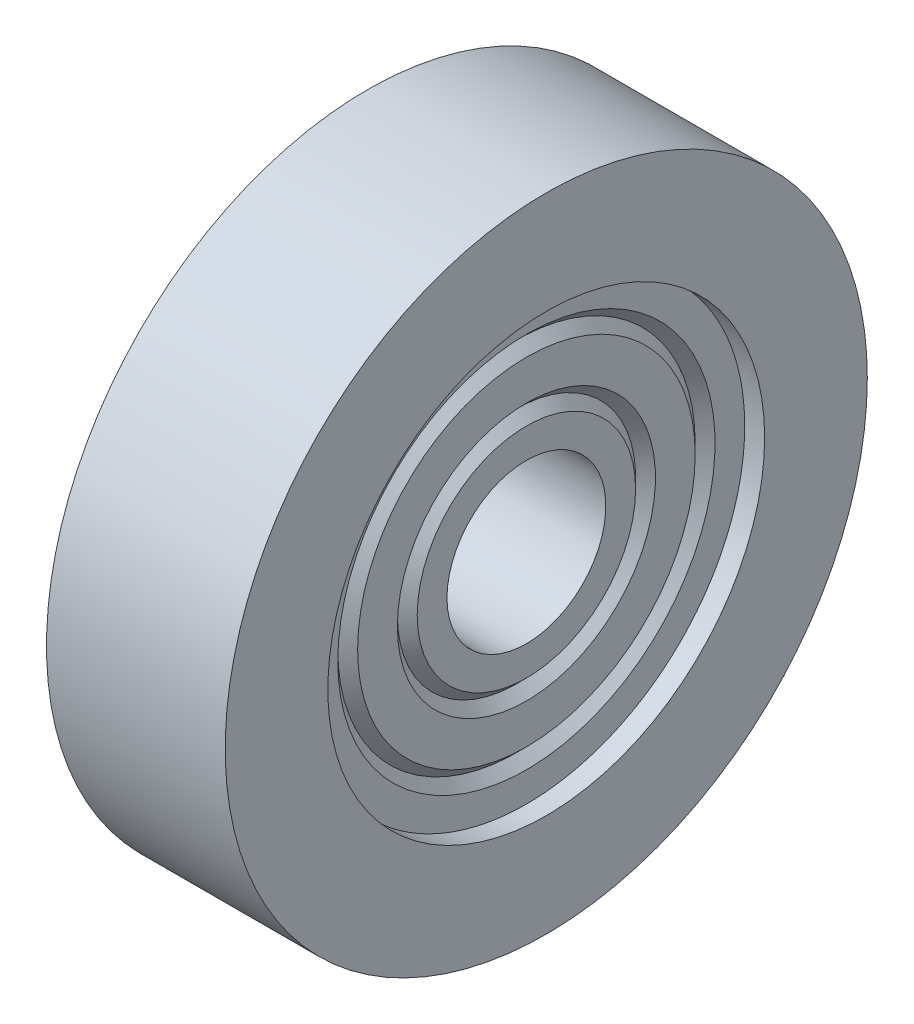
from build123d import *

# Parameters (mm, degrees)
ESQUISSE2_R        = 16.17
ESQUISSE2_R_2      = 11
BOSS_EXTRU_1_DEPTH = 4.5


with BuildPart() as part:
    # Esquisse1 → Base-Révolution (revolve)
    with BuildSketch(Plane.XY, mode=Mode.PRIVATE) as base_r_volution_sk:
        Polygon((-3.5, 4), (3.5, 4), (3.5, 5.5), (3, 6), (3.5, 6.5), (3.5, 8.5), (3, 9), (3.5, 9.5), (3.5, 11), (-3.5, 11), (-3.5, 9.5), (-3, 9), (-3.5, 8.5), (-3.5, 6.5), (-3, 6), (-3.5, 5.5), align=None)
    revolve(base_r_volution_sk.sketch.rotate(Axis((0, 0, 0), (1, 0, 0)), 90), axis=Axis((0, 0, 0), (1, 0, 0)))


with BuildPart() as body_2:
    # Esquisse2 → Boss.-Extru.1 (new, symmetric)
    with BuildSketch(Plane(origin=(0, 0, 0), x_dir=(0, 0, -1), z_dir=(1, 0, 0))):
        Circle(ESQUISSE2_R)
        Circle(ESQUISSE2_R_2, mode=Mode.SUBTRACT)
    extrude(amount=BOSS_EXTRU_1_DEPTH, both=True)


solid = Compound([part.part, body_2.part])
